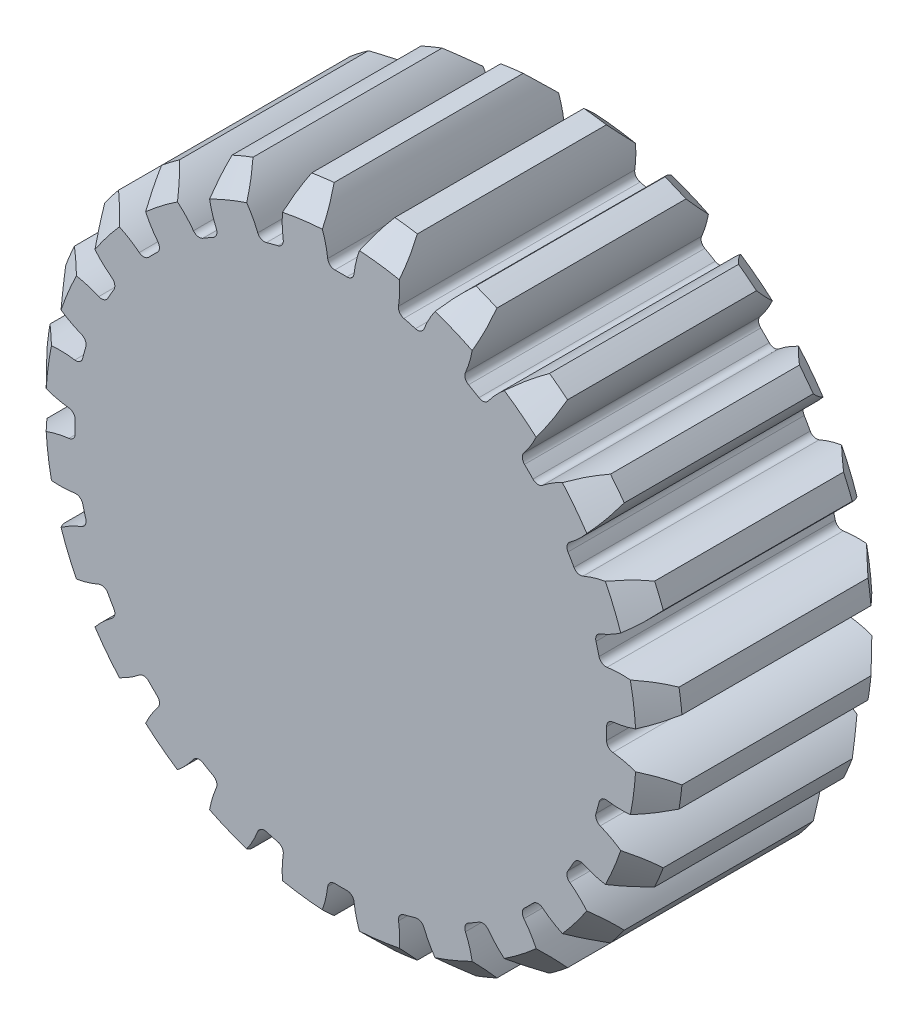
from build123d import *

# Parameters (mm, degrees)
SKETCH1_R                = 27
BOSS_EXTRUDE1_DEPTH      = 10
CUT_EXTRUDE1_DEPTH       = 44.104524125
FILLET1_R                = 0.6
CHAMFER1_SIZE            = 2
CIRPATTERN1_COUNT        = 24
FILLET1_OF_CIRPATTERN1_R = 0.6


with BuildPart() as part:
    # Sketch1 → Boss-Extrude1 (new, symmetric)
    with BuildSketch(Plane.XY):
        Circle(SKETCH1_R)
    extrude(amount=BOSS_EXTRUDE1_DEPTH, both=True)

    # Sketch3 → Cut-Extrude1 (cut, symmetric)
    with BuildSketch(Plane.XY.offset(10)):
        with BuildLine():
            ThreePointArc((1.072022538, 22.474446994), (0, 22.5), (-1.072022538, 22.474446994))
            ThreePointArc((-1.072022538, 22.474446994), (-1.510220721, 24.781486697), (-2.569085244, 26.877496182))
            ThreePointArc((-2.569085244, 26.877496182), (0, 27), (2.569085244, 26.877496182))
            ThreePointArc((2.569085244, 26.877496182), (1.510220721, 24.781486697), (1.072022538, 22.474446994))
        make_face()
    cut_extrude1 = extrude(amount=CUT_EXTRUDE1_DEPTH, both=True, mode=Mode.SUBTRACT)

    # Fillet1
    fillet1_edges = [part.edges().sort_by_distance(p)[0] for p in [
        (1.072022538, 22.474446994, 0),
        (-1.072022538, 22.474446994, 0),
    ]]
    fillet(fillet1_edges, radius=FILLET1_R)

    # Chamfer1
    chamfer1_edges = [part.edges().sort_by_distance(p)[0] for p in [
        (0, -27, -10),
        (0, -27, 10),
    ]]
    chamfer(chamfer1_edges, length=CHAMFER1_SIZE)

    # CirPattern1: Cut-Extrude1 ×24 about axis
    cirpattern1_axis = Axis((0, 0, 0), (0, 0, 1))
    for i in range(1, CIRPATTERN1_COUNT):
        add(cut_extrude1.rotate(cirpattern1_axis, i * 360 / CIRPATTERN1_COUNT), mode=Mode.SUBTRACT)

    # Fillet1 of CirPattern1
    fillet1_of_cirpattern1_edges = [part.edges().sort_by_distance(p)[0] for p in [
        (-4.781320654, 21.986108632, 0),
        (-6.852309166, 21.431188933, 0),
        (-10.308824746, 19.999453302, 0),
        (-12.165622248, 18.927430764, 0),
        (-15.133799467, 16.649868279, 0),
        (-16.649868279, 15.133799467, 0),
        (-18.927430764, 12.165622248, 0),
        (-19.999453302, 10.308824746, 0),
        (-21.431188933, 6.852309166, 0),
        (-21.986108632, 4.781320654, 0),
        (-22.474446994, 1.072022538, 0),
        (-22.474446994, -1.072022538, 0),
        (-21.986108632, -4.781320654, 0),
        (-21.431188933, -6.852309166, 0),
        (-19.999453302, -10.308824746, 0),
        (-18.927430764, -12.165622248, 0),
        (-16.649868279, -15.133799467, 0),
        (-15.133799467, -16.649868279, 0),
        (-12.165622248, -18.927430764, 0),
        (-10.308824746, -19.999453302, 0),
        (-6.852309166, -21.431188933, 0),
        (-4.781320654, -21.986108632, 0),
        (-1.072022538, -22.474446994, 0),
        (1.072022538, -22.474446994, 0),
        (4.781320654, -21.986108632, 0),
        (6.852309166, -21.431188933, 0),
        (10.308824746, -19.999453302, 0),
        (12.165622248, -18.927430764, 0),
        (15.133799467, -16.649868279, 0),
        (16.649868279, -15.133799467, 0),
        (18.927430764, -12.165622248, 0),
        (19.999453302, -10.308824746, 0),
        (21.431188933, -6.852309166, 0),
        (21.986108632, -4.781320654, 0),
        (22.474446994, -1.072022538, 0),
        (22.474446994, 1.072022538, 0),
        (21.986108632, 4.781320654, 0),
        (21.431188933, 6.852309166, 0),
        (19.999453302, 10.308824746, 0),
        (18.927430764, 12.165622248, 0),
        (16.649868279, 15.133799467, 0),
        (15.133799467, 16.649868279, 0),
        (12.165622248, 18.927430764, 0),
        (10.308824746, 19.999453302, 0),
        (6.852309166, 21.431188933, 0),
        (4.781320654, 21.986108632, 0),
    ]]
    fillet(fillet1_of_cirpattern1_edges, radius=FILLET1_OF_CIRPATTERN1_R)


solid = part.part
